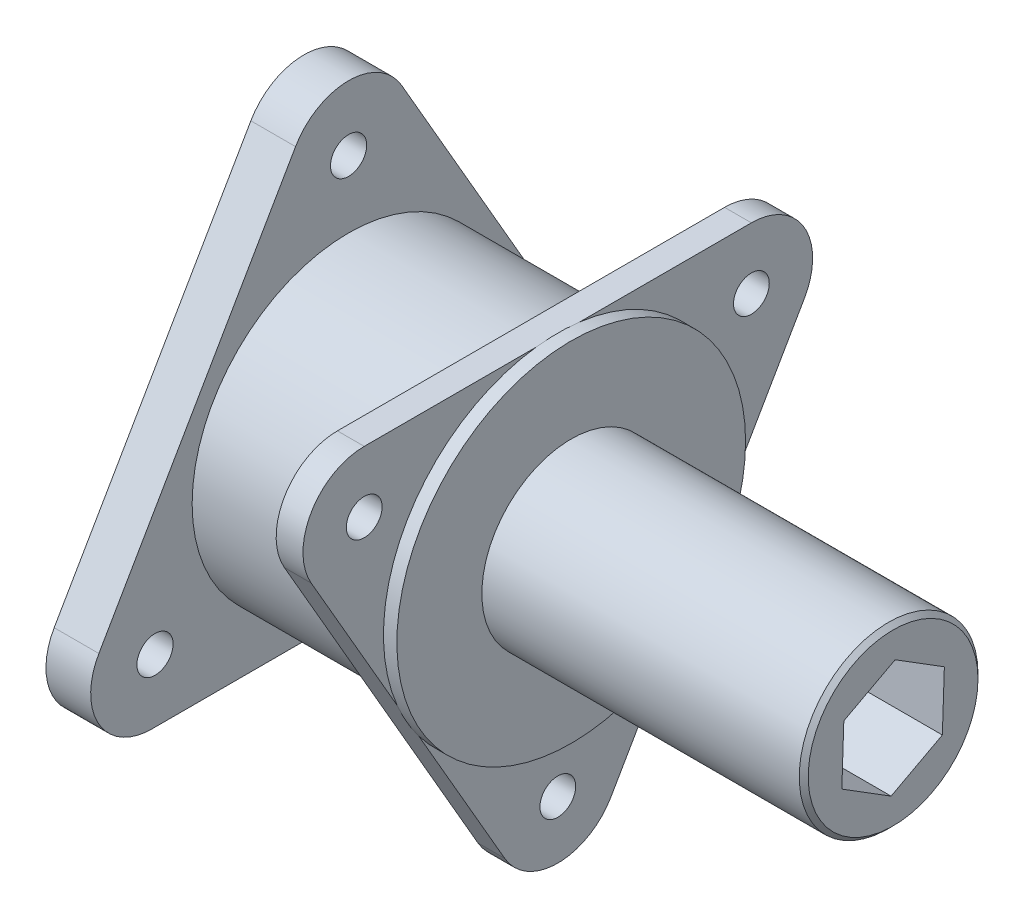
from build123d import *

# Parameters (mm, degrees)
SKETCH10_R           = 4.05
BOSS_EXTRUDE12_DEPTH = 10
SKETCH11_R           = 35
BOSS_EXTRUDE13_DEPTH = 40.8
SKETCH12_R           = 4
BOSS_EXTRUDE14_DEPTH = 6
SKETCH13_R           = 19.993
BOSS_EXTRUDE15_DEPTH = 75
SKETCH16_R           = 39
BOSS_EXTRUDE16_DEPTH = 3
CHAMFER1_SIZE        = 1
CUT_EXTRUDE2_DEPTH   = 131.8


with BuildPart() as part:
    # Sketch10 → Boss-Extrude12 (new body)
    with BuildSketch(Plane(origin=(0, 0, 0), x_dir=(0, 0, -1), z_dir=(1, 0, 0))):
        with BuildLine():
            Line((-55.858638544, -18.55), (-11.864548032, 57.65))
            ThreePointArc((-11.864548032, 57.65), (0, 64.5), (11.864548032, 57.65))
            Line((11.864548032, 57.65), (55.858638544, -18.55))
            ThreePointArc((55.858638544, -18.55), (55.858638544, -32.25), (43.994090512, -39.1))
            Line((43.994090512, -39.1), (-43.994090512, -39.1))
            ThreePointArc((-43.994090512, -39.1), (-55.858638544, -32.25), (-55.858638544, -18.55))
        make_face()
        with Locations((0, 50)):
            Circle(SKETCH10_R, mode=Mode.SUBTRACT)
        with Locations((43.301270189, -25)):
            Circle(SKETCH10_R, mode=Mode.SUBTRACT)
        with Locations((-43.301270189, -25)):
            Circle(SKETCH10_R, mode=Mode.SUBTRACT)
    extrude(amount=BOSS_EXTRUDE12_DEPTH)

    # Sketch11 → Boss-Extrude13 (add)
    with BuildSketch(Plane(origin=(10, 0, 0), x_dir=(0, 0, -1), z_dir=(1, 0, 0))):
        Circle(SKETCH11_R)
    extrude(amount=BOSS_EXTRUDE13_DEPTH)

    # Sketch12 → Boss-Extrude14 (add)
    with BuildSketch(Plane(origin=(50.8, 0, 0), x_dir=(0, 0, -1), z_dir=(1, 0, 0))):
        with BuildLine():
            Line((-43.301270189, 38.7), (43.301270189, 38.7))
            ThreePointArc((43.301270189, 38.7), (55.165818221, 31.85), (55.165818221, 18.15))
            Line((55.165818221, 18.15), (11.864548032, -56.85))
            ThreePointArc((11.864548032, -56.85), (0, -63.7), (-11.864548032, -56.85))
            Line((-11.864548032, -56.85), (-55.165818221, 18.15))
            ThreePointArc((-55.165818221, 18.15), (-55.165818221, 31.85), (-43.301270189, 38.7))
        make_face()
        with Locations((43.301270189, 25)):
            Circle(SKETCH12_R, mode=Mode.SUBTRACT)
        with Locations((0, -50.8)):
            Circle(SKETCH12_R, mode=Mode.SUBTRACT)
        with Locations((-43.301270189, 25)):
            Circle(SKETCH12_R, mode=Mode.SUBTRACT)
    extrude(amount=BOSS_EXTRUDE14_DEPTH)

    # Sketch13 → Boss-Extrude15 (add)
    with BuildSketch(Plane(origin=(56.8, 0, 0), x_dir=(0, 0, -1), z_dir=(1, 0, 0))):
        Circle(SKETCH13_R)
    extrude(amount=BOSS_EXTRUDE15_DEPTH)

    # Sketch16 → Boss-Extrude16 (add)
    with BuildSketch(Plane(origin=(56.8, 0, 0), x_dir=(0, 0, -1), z_dir=(1, 0, 0))):
        with Locations(Location((0, 0, 0), (0, 0, 202.888769737))):
            Circle(SKETCH16_R)
    extrude(amount=BOSS_EXTRUDE16_DEPTH)

    # Chamfer1
    chamfer1_edges = [part.edges().sort_by_distance(p)[0] for p in [
        (131.8, 0, 19.993),
    ]]
    chamfer(chamfer1_edges, length=CHAMFER1_SIZE)

    # Sketch14 → Cut-Extrude2 (cut)
    with BuildSketch(Plane(origin=(131.8, 0, 0), x_dir=(0, 0, -1), z_dir=(1, 0, 0))):
        Polygon((-11.46619671, -6.10543471), (-0.445636795, -12.982734991), (11.020559915, -6.877300281), (11.46619671, 6.10543471), (0.445636795, 12.982734991), (-11.020559915, 6.877300281), align=None)
    extrude(amount=-CUT_EXTRUDE2_DEPTH, mode=Mode.SUBTRACT)


solid = part.part
